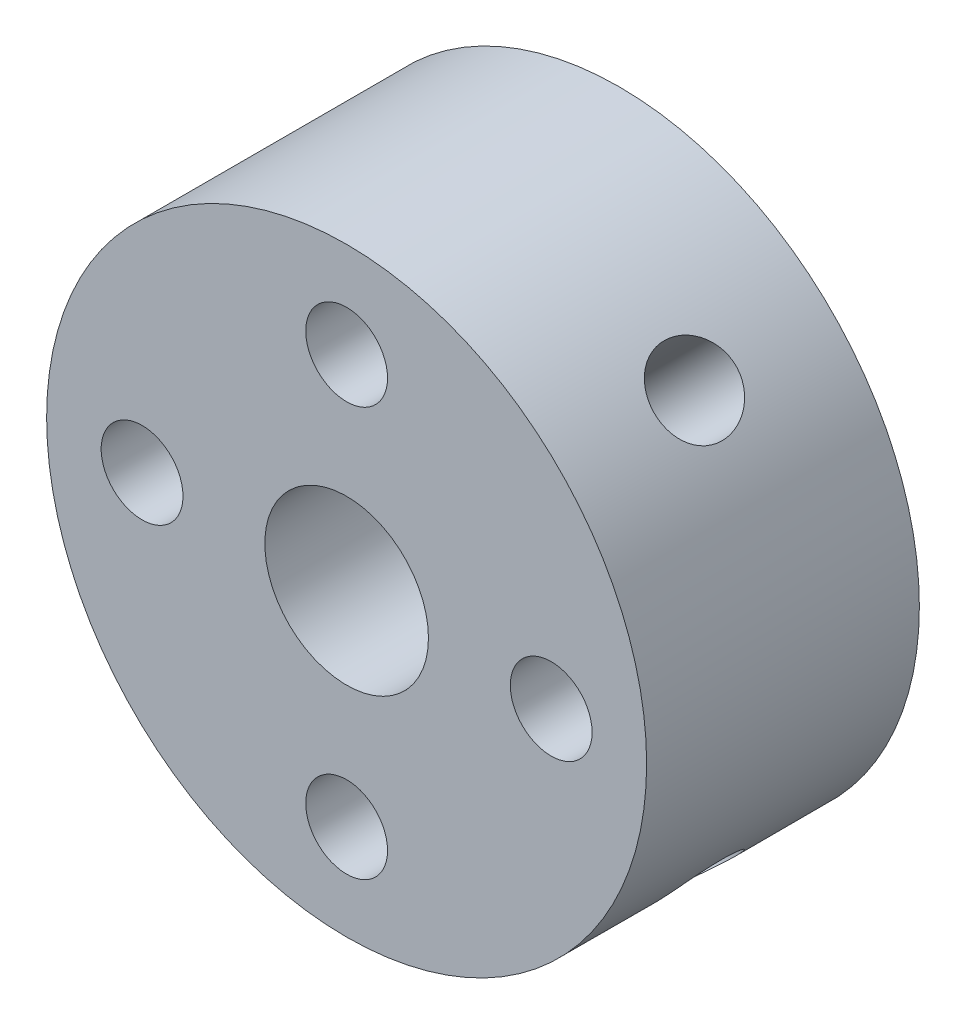
from build123d import *

# Parameters (mm, degrees)
SKETCH_1_R               = 11
SKETCH_1_R_2             = 3
SKETCH_1_R_3             = 1.5
EXTRUDE_1_DEPTH          = 10
CUT_EXTRUDE_1_REACH      = 20.493
CUT_EXTRUDE_1_END_RADIUS = 11
SKETCH_2_R               = 1.5
CUT_EXTRUDE_2_REACH      = 20.493
CUT_EXTRUDE_2_END_RADIUS = 11
SKETCH_3_R               = 1.5


with BuildPart() as part:
    # ｽｹｯﾁ1 → ﾎﾞｽ - 押し出し1 (new body)
    with BuildSketch(Plane.XY):
        Circle(SKETCH_1_R)
        Circle(SKETCH_1_R_2, mode=Mode.SUBTRACT)
        with Locations((-7.5, 0)):
            Circle(SKETCH_1_R_3, mode=Mode.SUBTRACT)
        with Locations((7.5, 0)):
            Circle(SKETCH_1_R_3, mode=Mode.SUBTRACT)
        with Locations((0, 7.5)):
            Circle(SKETCH_1_R_3, mode=Mode.SUBTRACT)
        with Locations((0, -7.5)):
            Circle(SKETCH_1_R_3, mode=Mode.SUBTRACT)
    extrude(amount=EXTRUDE_1_DEPTH)

    # ｶｯﾄ - 押し出し1: up to this cylinder (the profile starts inside it)
    cut_extrude_1_end = Plane(origin=(0, 0, 5), z_dir=(0, 0, -1)) * Cylinder(CUT_EXTRUDE_1_END_RADIUS, 63.986, mode=Mode.PRIVATE)
    # ｽｹｯﾁ2 → ｶｯﾄ - 押し出し1 (cut, up to the surface)
    with BuildSketch(Plane(origin=(0, 0, 0), x_dir=(0.7071067811865477, -0.7071067811865475, 0), z_dir=(0.7071067811865475, 0.7071067811865477, 0)), mode=Mode.PRIVATE) as cut_extrude_1_sk1:
        with Locations((0, -5)):
            Circle(SKETCH_2_R)
    cut_extrude_1_tool1 = extrude(cut_extrude_1_sk1.sketch, amount=CUT_EXTRUDE_1_REACH, mode=Mode.PRIVATE) & cut_extrude_1_end
    add(cut_extrude_1_tool1.solids().sort_by_distance((0, 0, 5))[0], mode=Mode.SUBTRACT)

    # ｶｯﾄ - 押し出し2: up to this cylinder (the profile starts inside it)
    cut_extrude_2_end = Plane(origin=(0, 0, 5), z_dir=(0, 0, -1)) * Cylinder(CUT_EXTRUDE_2_END_RADIUS, 63.986, mode=Mode.PRIVATE)
    # ｽｹｯﾁ3 → ｶｯﾄ - 押し出し2 (cut, up to the surface)
    with BuildSketch(Plane(origin=(0, 0, 0), x_dir=(0.7071067811865477, 0.7071067811865475, 0), z_dir=(-0.7071067811865475, 0.7071067811865477, 0)), mode=Mode.PRIVATE) as cut_extrude_2_sk1:
        with Locations(Location((0, -5, 0), (0, 0, 180))):
            Circle(SKETCH_3_R)
    cut_extrude_2_tool1 = extrude(cut_extrude_2_sk1.sketch, amount=-CUT_EXTRUDE_2_REACH, mode=Mode.PRIVATE) & cut_extrude_2_end
    add(cut_extrude_2_tool1.solids().sort_by_distance((0, 0, 5))[0], mode=Mode.SUBTRACT)


solid = part.part
